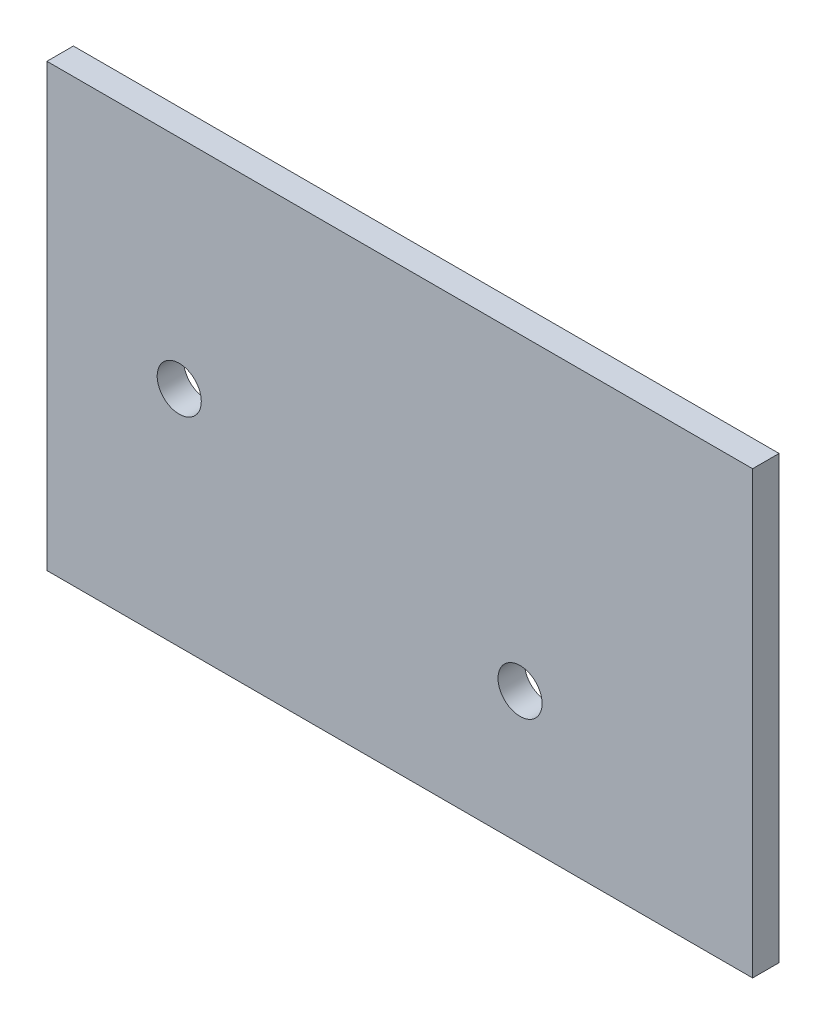
from build123d import *

# Parameters (mm, degrees)
SKETCH_1_W          = 80
SKETCH_1_H          = 50
EXTRUDE_1_DEPTH     = 3
SKETCH_2_R          = 2.5
CUT_EXTRUDE_2_DEPTH = 74.885045848


with BuildPart() as part:
    # 草圖1 → 伸長1 (new body)
    with BuildSketch(Plane.XY):
        with Locations((25, 10)):
            Rectangle(SKETCH_1_W, SKETCH_1_H)
    extrude(amount=EXTRUDE_1_DEPTH)

    # 草圖2 → 伸長2 (cut, through all)
    with BuildSketch(Plane.XY.offset(3)):
        with Locations((0, 10.352761804)):
            Circle(SKETCH_2_R)
        with Locations((38.637033052, 0)):
            Circle(SKETCH_2_R)
    extrude(amount=-CUT_EXTRUDE_2_DEPTH, mode=Mode.SUBTRACT)


solid = part.part
